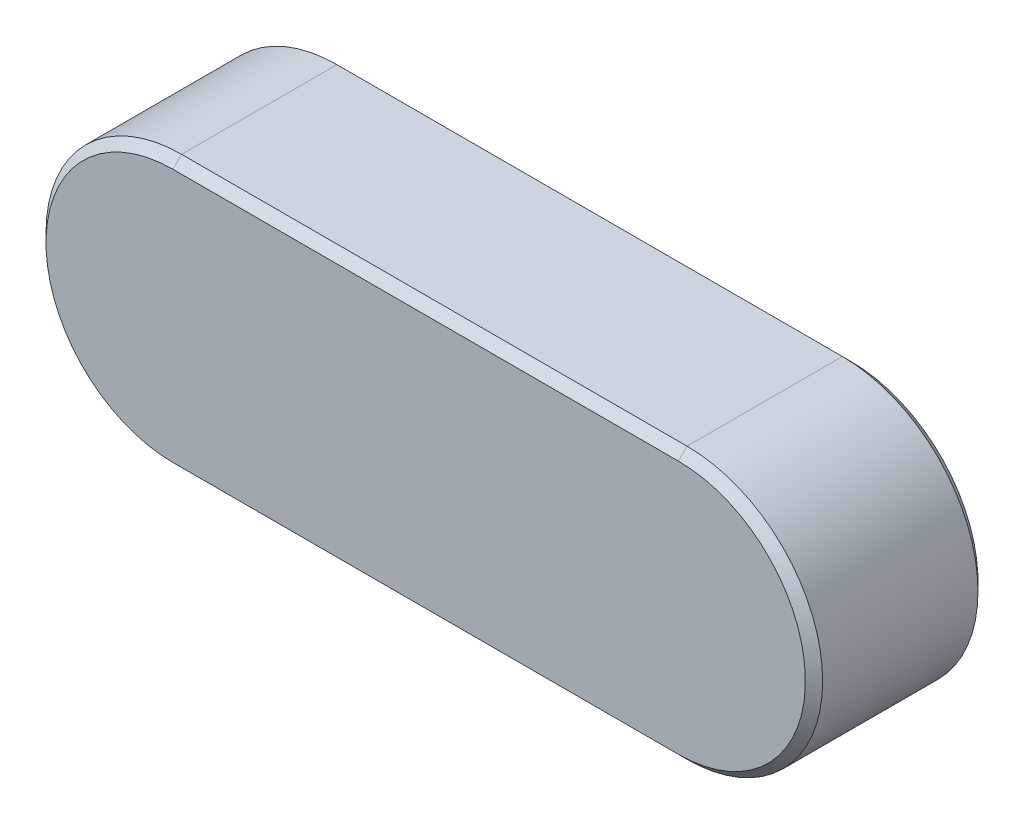
from build123d import *

# Parameters (mm, degrees)
ESTRUSIONE_ESTRUSIONE1_DEPTH = 14
SMUSSO1_SIZE                 = 0.7


with BuildPart() as part:
    # Schizzo1 → Estrusione-Estrusione1 (new body)
    with BuildSketch(Plane.XY):
        with BuildLine():
            Line((-20.5, 11), (20.5, 11))
            ThreePointArc((20.5, 11), (31.5, 0), (20.5, -11))
            Line((20.5, -11), (-20.5, -11))
            ThreePointArc((-20.5, -11), (-31.5, 0), (-20.5, 11))
        make_face()
    extrude(amount=ESTRUSIONE_ESTRUSIONE1_DEPTH)

    # Smusso1
    smusso1_edges = [part.edges().sort_by_distance(p)[0] for p in [
        (31.5, 0, 14),
        (0, 11, 14),
        (-31.5, 0, 14),
        (0, 11, 0),
        (31.5, 0, 0),
        (0, -11, 0),
        (-31.5, 0, 0),
        (0, -11, 14),
    ]]
    chamfer(smusso1_edges, length=SMUSSO1_SIZE)


solid = part.part
